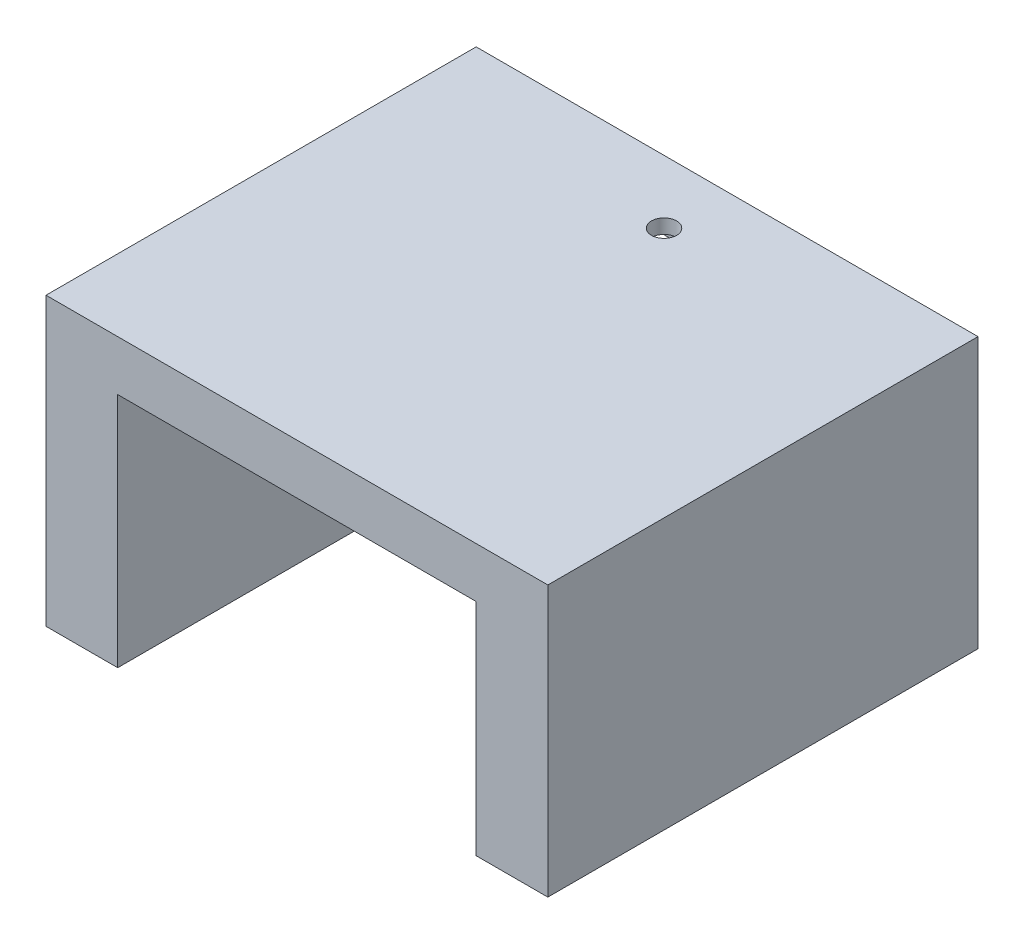
from build123d import *

# Parameters (mm, degrees)
BOSS_EXTRUDE1_DEPTH     = 60
CUT_EXTRUDE1_DEPTH      = 91.329016086
CUT_EXTRUDE1_DEPTH_BACK = 91.329016086
SKETCH2_R               = 1.75
SKETCH3_W               = 14.779269325
SKETCH3_H               = 12.394379378
CUT_EXTRUDE2_DEPTH      = 5


with BuildPart() as part:
    # Sketch1 → Boss-Extrude1 (new body)
    with BuildSketch(Plane.XY):
        Polygon((-58.909516608, -8.322842348), (-58.909516608, -48.322842348), (-48.909516608, -48.322842348), (-48.909516608, -15.322842348), (1.090483392, -15.322842348), (1.090483392, -46.033822892), (11.090483392, -46.033822892), (11.090483392, -8.322842348), align=None)
    extrude(amount=BOSS_EXTRUDE1_DEPTH)

    # Sketch2 → Cut-Extrude1 (cut, two sides: drawn at the far end of the back side and taken through both)
    with BuildSketch(Plane(origin=(0, -15.322842348, 0), x_dir=(1, 0, 0), z_dir=(0, 1, 0)).offset(-CUT_EXTRUDE1_DEPTH_BACK)):
        with Locations(Location((-23.909516608, -8.79280196, 0), (0, 0, 270))):
            Circle(SKETCH2_R)
    extrude(amount=CUT_EXTRUDE1_DEPTH + CUT_EXTRUDE1_DEPTH_BACK, mode=Mode.SUBTRACT)

    # Sketch3 → Cut-Extrude2 (cut)
    with BuildSketch(Plane(origin=(0, -15.322842348, 0), x_dir=(-1, 0, 0), z_dir=(0, -1, 0))):
        with Locations((23.909516609, -8.79280196)):
            Rectangle(SKETCH3_W, SKETCH3_H)
    extrude(amount=-CUT_EXTRUDE2_DEPTH, mode=Mode.SUBTRACT)


solid = part.part
